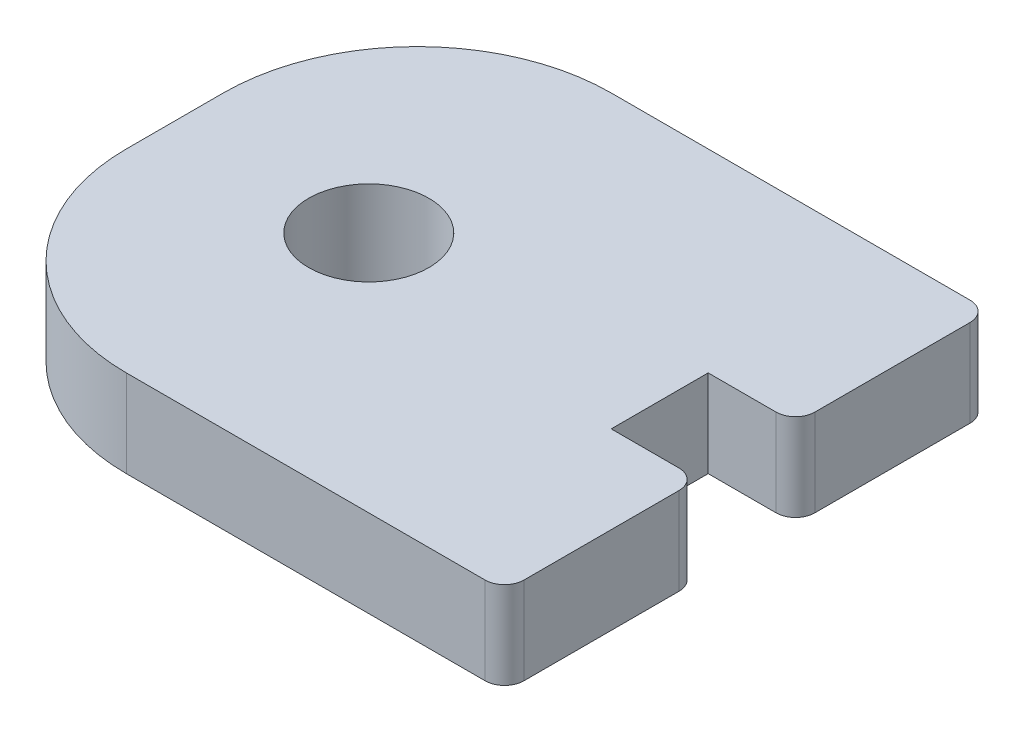
from build123d import *

# Parameters (mm, degrees)
SKETCH1_R           = 3.1
BOSS_EXTRUDE1_DEPTH = 4.5


with BuildPart() as part:
    # Sketch1 → Boss-Extrude1 (new body)
    with BuildSketch(Plane(origin=(0, 0, 0), x_dir=(1, 0, 0), z_dir=(0, 1, 0))):
        with BuildLine():
            Line((10, 0), (25, 0))
            Line((25, 0), (28.5, 0))
            ThreePointArc((28.5, 0), (29.207106781, 0.292893219), (29.5, 1))
            Line((29.5, 1), (29.5, 9))
            ThreePointArc((29.5, 9), (29.207106781, 9.707106781), (28.5, 10))
            Line((28.5, 10), (25, 10))
            Line((25, 10), (25, 15))
            Line((25, 15), (28.5, 15))
            ThreePointArc((28.5, 15), (29.207106781, 15.292893219), (29.5, 16))
            Line((29.5, 16), (29.5, 24))
            ThreePointArc((29.5, 24), (29.207106781, 24.707106781), (28.5, 25))
            Line((28.5, 25), (25, 25))
            Line((25, 25), (10, 25))
            ThreePointArc((10, 25), (2.928932188, 22.071067812), (0, 15))
            Line((0, 15), (0, 10))
            ThreePointArc((0, 10), (2.928932188, 2.928932188), (10, 0))
        make_face()
        with Locations(Location((10, 12.5, 0), (0, 0, 270))):
            Circle(SKETCH1_R, mode=Mode.SUBTRACT)
    extrude(amount=BOSS_EXTRUDE1_DEPTH)


solid = part.part
